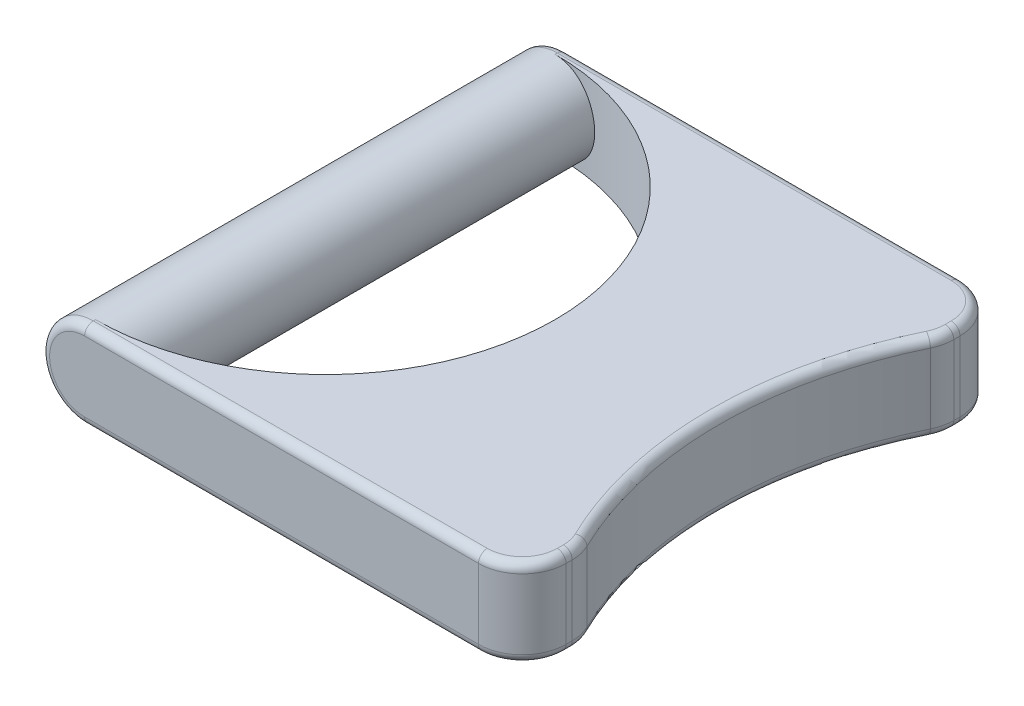
from build123d import *

# Parameters (mm, degrees)
SKETCH1_R           = 1
BOSS_EXTRUDE1_DEPTH = 5.5
BOSS_EXTRUDE2_DEPTH = 1
FILLET1_R           = 0.2


with BuildPart() as part:
    # Sketch1 → Boss-Extrude1 (new, symmetric)
    with BuildSketch(Plane.XY):
        Circle(SKETCH1_R)
    extrude(amount=BOSS_EXTRUDE1_DEPTH, both=True)

    # Sketch2 → Boss-Extrude2 (add, symmetric)
    with BuildSketch(Plane(origin=(0, 0, 0), x_dir=(1, 0, 0), z_dir=(0, 1, 0))):
        with BuildLine():
            Line((0, 5.5), (9, 5.5))
            ThreePointArc((9, 5.5), (9.707106781, 5.207106781), (10, 4.5))
            Line((10, 4.5), (10, 4.358898944))
            ThreePointArc((10, 4.358898944), (9.974679434, 4.135292146), (9.9, 3.923009049))
            ThreePointArc((9.9, 3.923009049), (9, 0), (9.9, -3.923009049))
            ThreePointArc((9.9, -3.923009049), (9.974679434, -4.135292146), (10, -4.358898944))
            Line((10, -4.358898944), (10, -4.5))
            ThreePointArc((10, -4.5), (9.707106781, -5.207106781), (9, -5.5))
            Line((9, -5.5), (0, -5.5))
            Line((0, -5.5), (0, -5.25))
            ThreePointArc((0, -5.25), (5.25, 0), (0, 5.25))
            Line((0, 5.25), (0, 5.5))
        make_face()
    extrude(amount=BOSS_EXTRUDE2_DEPTH, both=True)

    # Fillet1
    fillet1_edges = [part.edges().sort_by_distance(p)[0] for p in [
        (4.5, -1, 5.5),
        (9.707106781, -1, 5.207106781),
        (10, -1, 4.429449472),
        (9.974679434, -1, 4.135292146),
        (9, -1, 0),
        (9.974679434, -1, -4.135292146),
        (10, -1, -4.429449472),
        (9.707106781, -1, -5.207106781),
        (4.5, -1, -5.5),
        (4.5, 1, 5.5),
        (9.707106781, 1, 5.207106781),
        (10, 1, 4.429449472),
        (9.974679434, 1, 4.135292146),
        (9, 1, 0),
        (9.974679434, 1, -4.135292146),
        (10, 1, -4.429449472),
        (-1, 0, -5.5),
        (9.707106781, 1, -5.207106781),
        (4.5, 1, -5.5),
        (-1, 0, 5.5),
    ]]
    fillet(fillet1_edges, radius=FILLET1_R)


solid = part.part
